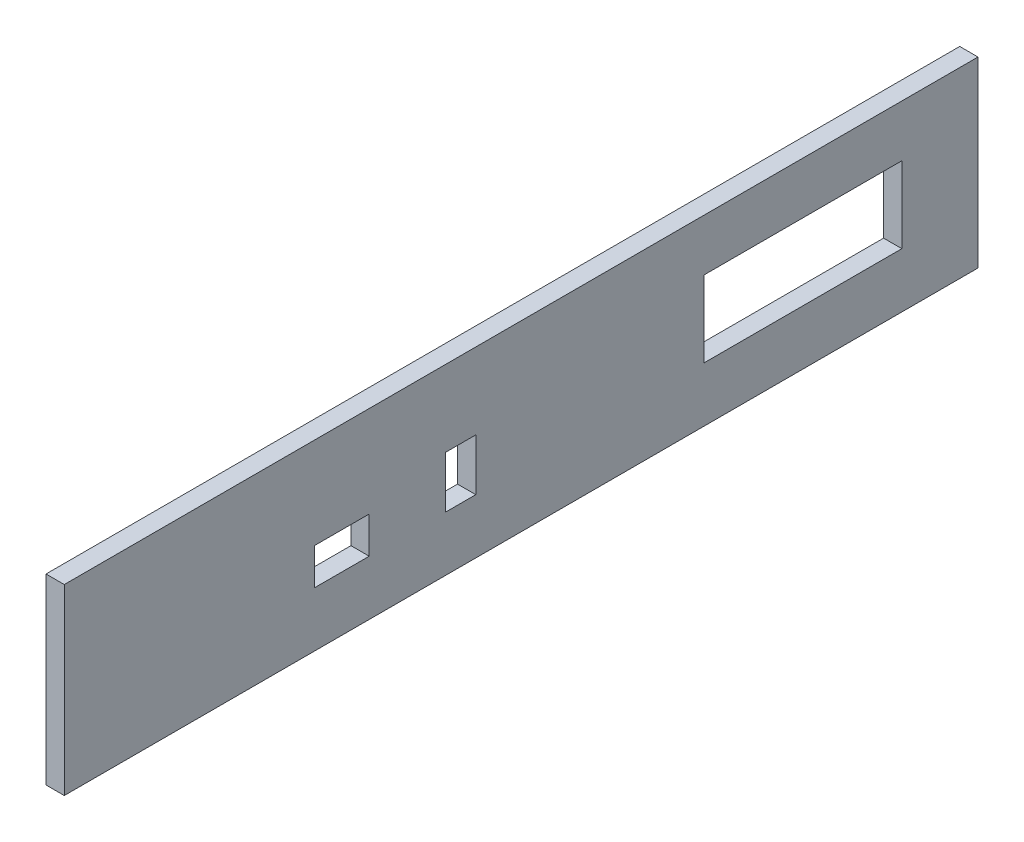
from build123d import *

# Parameters (mm, degrees)
SKETCH1_W           = 300
SKETCH1_H           = 60
SKETCH1_W_2         = 65
SKETCH1_H_2         = 25
SKETCH1_W_3         = 10
SKETCH1_H_3         = 17
SKETCH1_W_4         = 18
SKETCH1_H_4         = 12
BOSS_EXTRUDE1_DEPTH = 6


with BuildPart() as part:
    # Sketch1 → Boss-Extrude1 (new body)
    with BuildSketch(Plane(origin=(0, 0, 0), x_dir=(0, 0, -1), z_dir=(1, 0, 0))):
        Rectangle(SKETCH1_W, SKETCH1_H)
        with Locations((92.5, 0.5)):
            Rectangle(SKETCH1_W_2, SKETCH1_H_2, mode=Mode.SUBTRACT)
        with Locations((-19.885059814, -3.5)):
            Rectangle(SKETCH1_W_3, SKETCH1_H_3, mode=Mode.SUBTRACT)
        with Locations((-58.885059814, -6)):
            Rectangle(SKETCH1_W_4, SKETCH1_H_4, mode=Mode.SUBTRACT)
    extrude(amount=BOSS_EXTRUDE1_DEPTH)


solid = part.part
